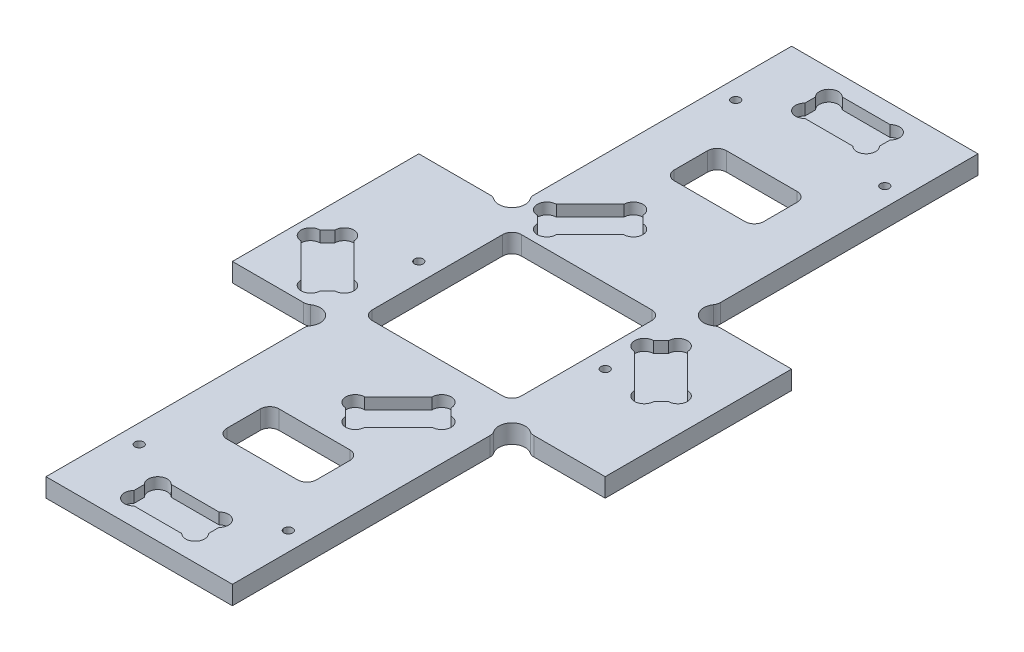
from build123d import *

# Parameters (mm, degrees)
SKETCH1_W                = 31.75
SKETCH1_H                = 63.5
BOSS_EXTRUDE1_DEPTH      = 6.35
CUT_EXTRUDE14_DEPTH      = 3.81
SKETCH14_W               = 25.4
SKETCH14_H               = 12.7
CUT_EXTRUDE16_DEPTH      = 3.81
SKETCH15_W               = 30.48
SKETCH15_H               = 17.78
SKETCH15_W_2             = 50.8
SKETCH15_H_2             = 50.8
CUT_EXTRUDE17_DEPTH      = 271.379606021
FILLET1_R                = 3.175
SKETCH16_R               = 4.490128061
SKETCH16_W               = 3.175
SKETCH16_H               = 3.175
CUT_EXTRUDE18_DEPTH      = 271.379606021
FILLET2_R                = 3.175
SKETCH17_W               = 2.286
SKETCH17_H               = 2.286
SKETCH17_R               = 3.232892204
CUT_EXTRUDE19_DEPTH      = 3.81
SKETCH18_R               = 3.232892204
CUT_EXTRUDE20_DEPTH      = 3.81
SKETCH19_R               = 3.232892204
CUT_EXTRUDE22_DEPTH      = 3.81
CUT_EXTRUDE23_DEPTH      = 271.379606021
CUT_EXTRUDE23_DEPTH_BACK = 271.379606021
SKETCH20_R               = 1.4732


with BuildPart() as part:
    # Sketch1 → Boss-Extrude1 (new body)
    with BuildSketch(Plane(origin=(0, 0, 0), x_dir=(1, 0, 0), z_dir=(0, 1, 0))):
        with Locations((-2.219314381, 120.395150502)):
            Rectangle(SKETCH1_W, SKETCH1_H)
        Polygon((45.405685619, -6.604849498), (45.405685619, 247.395150502), (13.655685619, 247.395150502), (13.655685619, 152.145150502), (13.655685619, 88.645150502), (13.655685619, -6.604849498), align=None)
        Polygon((77.155685619, 247.395150502), (45.405685619, 247.395150502), (45.405685619, -6.604849498), (77.155685619, -6.604849498), (77.155685619, 88.645150502), (77.155685619, 152.145150502), align=None)
        with Locations((93.030685619, 120.395150502)):
            Rectangle(SKETCH1_W, SKETCH1_H)
    extrude(amount=BOSS_EXTRUDE1_DEPTH)

    # Sketch2 → Cut-Extrude14 (cut)
    with BuildSketch(Plane(origin=(0, 6.35, 0), x_dir=(1, 0, 0), z_dir=(0, 1, 0))):
        Polygon((-6.679799883, 118.599099277), (-15.660056005, 109.618843156), (2.300456238, 91.658330914), (11.280712359, 100.638587035), align=None)
        Polygon((25.962587035, 148.485287641), (16.982330914, 157.465543762), (34.942843156, 175.426056005), (43.923099277, 166.445799883), align=None)
        Polygon((73.809287641, 133.803412965), (82.789543762, 142.783669086), (100.750056005, 124.823156844), (91.769799883, 115.842900723), align=None)
        Polygon((59.127412965, 85.956712359), (68.107669086, 76.976456238), (50.147156844, 59.015943995), (41.166900723, 67.996200117), align=None)
    extrude(amount=-CUT_EXTRUDE14_DEPTH, mode=Mode.SUBTRACT)

    # Sketch14 → Cut-Extrude16 (cut)
    with BuildSketch(Plane(origin=(0, 6.35, 0), x_dir=(1, 0, 0), z_dir=(0, 1, 0))):
        with Locations((45.405685619, 234.695150502)):
            Rectangle(SKETCH14_W, SKETCH14_H)
        with Locations((45.405685619, 6.095150502)):
            Rectangle(SKETCH14_W, SKETCH14_H)
    extrude(amount=-CUT_EXTRUDE16_DEPTH, mode=Mode.SUBTRACT)

    # Sketch15 → Cut-Extrude17 (cut, through all)
    with BuildSketch(Plane(origin=(0, 6.35, 0), x_dir=(1, 0, 0), z_dir=(0, 1, 0))):
        with Locations((45.405685619, 44.195150502)):
            Rectangle(SKETCH15_W, SKETCH15_H)
        with Locations((45.405685619, 120.395150502)):
            Rectangle(SKETCH15_W_2, SKETCH15_H_2)
        with Locations((45.405685619, 196.595150502)):
            Rectangle(SKETCH15_W, SKETCH15_H)
    extrude(amount=-CUT_EXTRUDE17_DEPTH, mode=Mode.SUBTRACT)

    # Fillet1
    fillet1_edges = [part.edges().sort_by_distance(p)[0] for p in [
        (30.165685619, 3.175, -35.305150502),
        (30.165685619, 3.175, -53.085150502),
        (60.645685619, 3.175, -53.085150502),
        (60.645685619, 3.175, -35.305150502),
        (60.645685619, 3.175, -205.485150502),
        (60.645685619, 3.175, -187.705150502),
        (30.165685619, 3.175, -187.705150502),
        (30.165685619, 3.175, -205.485150502),
        (70.805685619, 3.175, -145.795150502),
        (70.805685619, 3.175, -94.995150502),
        (20.005685619, 3.175, -94.995150502),
        (20.005685619, 3.175, -145.795150502),
    ]]
    fillet(fillet1_edges, radius=FILLET1_R)

    # Sketch16 → Cut-Extrude18 (cut, through all)
    with BuildSketch(Plane(origin=(0, 6.35, 0), x_dir=(1, 0, 0), z_dir=(0, 1, 0))):
        with Locations((10.480685619, 85.470150502)):
            Circle(SKETCH16_R)
        with Locations((12.068185619, 87.057650502)):
            Rectangle(SKETCH16_W, SKETCH16_H)
        with Locations((12.068185619, 87.057650502)):
            Rectangle(SKETCH16_W, SKETCH16_H)
        with Locations((78.743185619, 87.057650502)):
            Rectangle(SKETCH16_W, SKETCH16_H)
        with Locations((80.330685619, 85.470150502)):
            Circle(SKETCH16_R)
        with Locations((78.743185619, 87.057650502)):
            Rectangle(SKETCH16_W, SKETCH16_H)
        with Locations((78.743185619, 153.732650502)):
            Rectangle(SKETCH16_W, SKETCH16_H)
        with Locations((80.330685619, 155.320150502)):
            Circle(SKETCH16_R)
        with Locations((78.743185619, 153.732650502)):
            Rectangle(SKETCH16_W, SKETCH16_H)
        with Locations((12.068185619, 153.732650502)):
            Rectangle(SKETCH16_W, SKETCH16_H)
        with Locations((10.480685619, 155.320150502)):
            Circle(SKETCH16_R)
        with Locations((12.068185619, 153.732650502)):
            Rectangle(SKETCH16_W, SKETCH16_H)
    extrude(amount=-CUT_EXTRUDE18_DEPTH, mode=Mode.SUBTRACT)

    # Fillet2
    fillet2_edges = [part.edges().sort_by_distance(p)[0] for p in [
        (7.305685619, 3.175, -152.145150502),
        (13.655685619, 3.175, -158.495150502),
        (83.505685619, 3.175, -152.145150502),
        (77.155685619, 3.175, -158.495150502),
        (77.155685619, 3.175, -82.295150502),
        (83.505685619, 3.175, -88.645150502),
        (7.305685619, 3.175, -88.645150502),
        (13.655685619, 3.175, -82.295150502),
    ]]
    fillet(fillet2_edges, radius=FILLET2_R)

    # Sketch17 → Cut-Extrude19 (cut)
    with BuildSketch(Plane(origin=(0, 6.35, 0), x_dir=(1, 0, 0), z_dir=(0, 1, 0))):
        with Locations((33.848685619, 239.902150502)):
            Rectangle(SKETCH17_W, SKETCH17_H)
        with Locations((34.991685619, 238.759150502)):
            Circle(SKETCH17_R)
        with Locations((33.848685619, 239.902150502)):
            Rectangle(SKETCH17_W, SKETCH17_H)
        with Locations((55.819685619, 238.759150502)):
            Circle(SKETCH17_R)
        with Locations((56.962685619, 239.902150502)):
            Rectangle(SKETCH17_W, SKETCH17_H)
        with Locations((56.962685619, 239.902150502)):
            Rectangle(SKETCH17_W, SKETCH17_H)
        with Locations((55.819685619, 230.631150502)):
            Circle(SKETCH17_R)
        with Locations((56.962685619, 229.488150502)):
            Rectangle(SKETCH17_W, SKETCH17_H)
        with Locations((56.962685619, 229.488150502)):
            Rectangle(SKETCH17_W, SKETCH17_H)
        with Locations((34.991685619, 230.631150502)):
            Circle(SKETCH17_R)
        with Locations((33.848685619, 229.488150502)):
            Rectangle(SKETCH17_W, SKETCH17_H)
        with Locations((33.848685619, 229.488150502)):
            Rectangle(SKETCH17_W, SKETCH17_H)
        with Locations((34.991685619, 2.031150502)):
            Circle(SKETCH17_R)
        with Locations((33.848685619, 0.888150502)):
            Rectangle(SKETCH17_W, SKETCH17_H)
        with Locations((33.848685619, 0.888150502)):
            Rectangle(SKETCH17_W, SKETCH17_H)
        with Locations((34.991685619, 10.159150502)):
            Circle(SKETCH17_R)
        with Locations((33.848685619, 11.302150502)):
            Rectangle(SKETCH17_W, SKETCH17_H)
        with Locations((33.848685619, 11.302150502)):
            Rectangle(SKETCH17_W, SKETCH17_H)
        with Locations((55.819685619, 10.159150502)):
            Circle(SKETCH17_R)
        with Locations((56.962685619, 11.302150502)):
            Rectangle(SKETCH17_W, SKETCH17_H)
        with Locations((56.962685619, 11.302150502)):
            Rectangle(SKETCH17_W, SKETCH17_H)
        with Locations((55.819685619, 2.031150502)):
            Circle(SKETCH17_R)
        with Locations((56.962685619, 0.888150502)):
            Rectangle(SKETCH17_W, SKETCH17_H)
        with Locations((56.962685619, 0.888150502)):
            Rectangle(SKETCH17_W, SKETCH17_H)
    extrude(amount=-CUT_EXTRUDE19_DEPTH, mode=Mode.SUBTRACT)

    # Sketch18 → Cut-Extrude20 (cut)
    with BuildSketch(Plane(origin=(0, 6.35, 0), x_dir=(1, 0, 0), z_dir=(0, 1, 0))):
        Polygon((-15.660056005, 109.618843156), (-14.043609903, 108.002397055), (-12.427163801, 109.618843156), (-14.043609903, 111.235289258), align=None)
        with Locations((-12.427163801, 109.618843156)):
            Circle(SKETCH18_R)
        Polygon((-15.660056005, 109.618843156), (-14.043609903, 108.002397055), (-12.427163801, 109.618843156), (-14.043609903, 111.235289258), align=None)
        Polygon((-6.679799883, 118.599099277), (-5.063353782, 116.982653176), (-6.679799883, 115.366207074), (-8.296245985, 116.982653176), align=None)
        with Locations((-6.679799883, 115.366207074)):
            Circle(SKETCH18_R)
        Polygon((-6.679799883, 118.599099277), (-8.296245985, 116.982653176), (-6.679799883, 115.366207074), (-5.063353782, 116.982653176), align=None)
        Polygon((9.664266257, 99.022140934), (8.047820155, 100.638587035), (9.664266257, 102.255033137), (11.280712359, 100.638587035), align=None)
        with Locations((8.047820155, 100.638587035)):
            Circle(SKETCH18_R)
        Polygon((11.280712359, 100.638587035), (9.664266257, 102.255033137), (8.047820155, 100.638587035), (9.664266257, 99.022140934), align=None)
        Polygon((2.300456238, 91.658330914), (0.684010136, 93.274777016), (2.300456238, 94.891223118), (3.916902339, 93.274777016), align=None)
        with Locations((2.300456238, 94.891223118)):
            Circle(SKETCH18_R)
        Polygon((2.300456238, 91.658330914), (3.916902339, 93.274777016), (2.300456238, 94.891223118), (0.684010136, 93.274777016), align=None)
    extrude(amount=-CUT_EXTRUDE20_DEPTH, mode=Mode.SUBTRACT)

    # Sketch19 → Cut-Extrude22 (cut)
    # profile 1 of 27: a face of its own
    with BuildSketch(Plane(origin=(0, 6.35, 0), x_dir=(1, 0, 0), z_dir=(0, 1, 0))):
        with Locations((44.399792926, 67.996200117)):
            Circle(SKETCH19_R)
        Polygon((41.166900723, 67.996200117), (42.783346824, 66.379754015), (44.399792926, 67.996200117), (42.783346824, 69.612646218), align=None, mode=Mode.SUBTRACT)
    # profile 2 of 27: a face of its own
    with BuildSketch(Plane(origin=(0, 6.35, 0), x_dir=(1, 0, 0), z_dir=(0, 1, 0))):
        with Locations((50.147156844, 62.248836199)):
            Circle(SKETCH19_R)
        Polygon((50.147156844, 59.015943995), (51.763602945, 60.632390097), (50.147156844, 62.248836199), (48.530710742, 60.632390097), align=None, mode=Mode.SUBTRACT)
    # profile 3 of 27: a face of its own
    with BuildSketch(Plane(origin=(0, 6.35, 0), x_dir=(1, 0, 0), z_dir=(0, 1, 0))):
        Polygon((50.147156844, 59.015943995), (48.530710742, 60.632390097), (50.147156844, 62.248836199), (51.763602945, 60.632390097), align=None)
    # profile 4 of 27: a face of its own
    with BuildSketch(Plane(origin=(0, 6.35, 0), x_dir=(1, 0, 0), z_dir=(0, 1, 0))):
        Polygon((59.127412965, 85.956712359), (60.743859066, 84.340266257), (59.127412965, 82.723820155), (57.510966863, 84.340266257), align=None)
    # profile 5 of 27: a face of its own
    with BuildSketch(Plane(origin=(0, 6.35, 0), x_dir=(1, 0, 0), z_dir=(0, 1, 0))):
        with Locations((59.127412965, 82.723820155)):
            Circle(SKETCH19_R)
    # profile 6 of 27: a face of its own
    with BuildSketch(Plane(origin=(0, 6.35, 0), x_dir=(1, 0, 0), z_dir=(0, 1, 0))):
        Polygon((59.127412965, 85.956712359), (57.510966863, 84.340266257), (59.127412965, 82.723820155), (60.743859066, 84.340266257), align=None)
    # profile 7 of 27: a face of its own
    with BuildSketch(Plane(origin=(0, 6.35, 0), x_dir=(1, 0, 0), z_dir=(0, 1, 0))):
        Polygon((66.491222984, 75.360010136), (64.874776882, 76.976456238), (66.491222984, 78.592902339), (68.107669086, 76.976456238), align=None)
    # profile 8 of 27: a face of its own
    with BuildSketch(Plane(origin=(0, 6.35, 0), x_dir=(1, 0, 0), z_dir=(0, 1, 0))):
        with Locations((64.874776882, 76.976456238)):
            Circle(SKETCH19_R)
    # profile 9 of 27: a face of its own
    with BuildSketch(Plane(origin=(0, 6.35, 0), x_dir=(1, 0, 0), z_dir=(0, 1, 0))):
        Polygon((68.107669086, 76.976456238), (66.491222984, 78.592902339), (64.874776882, 76.976456238), (66.491222984, 75.360010136), align=None)
    # profile 10 of 27: a face of its own
    with BuildSketch(Plane(origin=(0, 6.35, 0), x_dir=(1, 0, 0), z_dir=(0, 1, 0))):
        with Locations((91.769799883, 119.075792926)):
            Circle(SKETCH19_R)
        Polygon((91.769799883, 115.842900723), (93.386245985, 117.459346824), (91.769799883, 119.075792926), (90.153353782, 117.459346824), align=None, mode=Mode.SUBTRACT)
    # profile 11 of 27: a face of its own
    with BuildSketch(Plane(origin=(0, 6.35, 0), x_dir=(1, 0, 0), z_dir=(0, 1, 0))):
        Polygon((91.769799883, 115.842900723), (93.386245985, 117.459346824), (91.769799883, 119.075792926), (90.153353782, 117.459346824), align=None)
    # profile 12 of 27: a face of its own
    with BuildSketch(Plane(origin=(0, 6.35, 0), x_dir=(1, 0, 0), z_dir=(0, 1, 0))):
        with Locations((97.517163801, 124.823156844)):
            Circle(SKETCH19_R)
        Polygon((100.750056005, 124.823156844), (99.133609903, 126.439602945), (97.517163801, 124.823156844), (99.133609903, 123.206710742), align=None, mode=Mode.SUBTRACT)
    # profile 13 of 27: a face of its own
    with BuildSketch(Plane(origin=(0, 6.35, 0), x_dir=(1, 0, 0), z_dir=(0, 1, 0))):
        Polygon((100.750056005, 124.823156844), (99.133609903, 123.206710742), (97.517163801, 124.823156844), (99.133609903, 126.439602945), align=None)
    # profile 14 of 27: a face of its own
    with BuildSketch(Plane(origin=(0, 6.35, 0), x_dir=(1, 0, 0), z_dir=(0, 1, 0))):
        with Locations((82.789543762, 139.550776882)):
            Circle(SKETCH19_R)
        Polygon((82.789543762, 142.783669086), (81.173097661, 141.167222984), (82.789543762, 139.550776882), (84.405989864, 141.167222984), align=None, mode=Mode.SUBTRACT)
    # profile 15 of 27: a face of its own
    with BuildSketch(Plane(origin=(0, 6.35, 0), x_dir=(1, 0, 0), z_dir=(0, 1, 0))):
        Polygon((84.405989864, 141.167222984), (82.789543762, 139.550776882), (81.173097661, 141.167222984), (82.789543762, 142.783669086), align=None)
    # profile 16 of 27: a face of its own
    with BuildSketch(Plane(origin=(0, 6.35, 0), x_dir=(1, 0, 0), z_dir=(0, 1, 0))):
        with Locations((77.042179845, 133.803412965)):
            Circle(SKETCH19_R)
        Polygon((73.809287641, 133.803412965), (75.425733743, 132.186966863), (77.042179845, 133.803412965), (75.425733743, 135.419859066), align=None, mode=Mode.SUBTRACT)
    # profile 17 of 27: a face of its own
    with BuildSketch(Plane(origin=(0, 6.35, 0), x_dir=(1, 0, 0), z_dir=(0, 1, 0))):
        Polygon((73.809287641, 133.803412965), (75.425733743, 135.419859066), (77.042179845, 133.803412965), (75.425733743, 132.186966863), align=None)
    # profile 18 of 27: a face of its own
    with BuildSketch(Plane(origin=(0, 6.35, 0), x_dir=(1, 0, 0), z_dir=(0, 1, 0))):
        with Locations((25.962587035, 151.718179845)):
            Circle(SKETCH19_R)
        Polygon((25.962587035, 148.485287641), (27.579033137, 150.101733743), (25.962587035, 151.718179845), (24.346140934, 150.101733743), align=None, mode=Mode.SUBTRACT)
    # profile 19 of 27: a face of its own
    with BuildSketch(Plane(origin=(0, 6.35, 0), x_dir=(1, 0, 0), z_dir=(0, 1, 0))):
        Polygon((25.962587035, 148.485287641), (27.579033137, 150.101733743), (25.962587035, 151.718179845), (24.346140934, 150.101733743), align=None)
    # profile 20 of 27: a face of its own
    with BuildSketch(Plane(origin=(0, 6.35, 0), x_dir=(1, 0, 0), z_dir=(0, 1, 0))):
        with Locations((20.215223118, 157.465543762)):
            Circle(SKETCH19_R)
        Polygon((16.982330914, 157.465543762), (18.598777016, 155.849097661), (20.215223118, 157.465543762), (18.598777016, 159.081989864), align=None, mode=Mode.SUBTRACT)
    # profile 21 of 27: a face of its own
    with BuildSketch(Plane(origin=(0, 6.35, 0), x_dir=(1, 0, 0), z_dir=(0, 1, 0))):
        Polygon((16.982330914, 157.465543762), (18.598777016, 159.081989864), (20.215223118, 157.465543762), (18.598777016, 155.849097661), align=None)
    # profile 22 of 27: a face of its own
    with BuildSketch(Plane(origin=(0, 6.35, 0), x_dir=(1, 0, 0), z_dir=(0, 1, 0))):
        Polygon((36.559289258, 173.809609903), (34.942843156, 172.193163801), (33.326397055, 173.809609903), (34.942843156, 175.426056005), align=None)
    # profile 23 of 27: a face of its own
    with BuildSketch(Plane(origin=(0, 6.35, 0), x_dir=(1, 0, 0), z_dir=(0, 1, 0))):
        with Locations((34.942843156, 172.193163801)):
            Circle(SKETCH19_R)
    # profile 24 of 27: a face of its own
    with BuildSketch(Plane(origin=(0, 6.35, 0), x_dir=(1, 0, 0), z_dir=(0, 1, 0))):
        Polygon((34.942843156, 175.426056005), (33.326397055, 173.809609903), (34.942843156, 172.193163801), (36.559289258, 173.809609903), align=None)
    # profile 25 of 27: a face of its own
    with BuildSketch(Plane(origin=(0, 6.35, 0), x_dir=(1, 0, 0), z_dir=(0, 1, 0))):
        with Locations((40.690207074, 166.445799883)):
            Circle(SKETCH19_R)
        Polygon((43.923099277, 166.445799883), (42.306653176, 168.062245985), (40.690207074, 166.445799883), (42.306653176, 164.829353782), align=None, mode=Mode.SUBTRACT)
    # profile 26 of 27: a face of its own
    with BuildSketch(Plane(origin=(0, 6.35, 0), x_dir=(1, 0, 0), z_dir=(0, 1, 0))):
        Polygon((43.923099277, 166.445799883), (42.306653176, 164.829353782), (40.690207074, 166.445799883), (42.306653176, 168.062245985), align=None)
    # profile 27 of 27: a face of its own
    with BuildSketch(Plane(origin=(0, 6.35, 0), x_dir=(1, 0, 0), z_dir=(0, 1, 0))):
        Polygon((41.166900723, 67.996200117), (42.783346824, 66.379754015), (44.399792926, 67.996200117), (42.783346824, 69.612646218), align=None)
    extrude(amount=-CUT_EXTRUDE22_DEPTH, mode=Mode.SUBTRACT)

    # Sketch20 → Cut-Extrude23 (cut, two sides: drawn at the far end of the back side and taken through both)
    with BuildSketch(Plane(origin=(0, 6.35, 0), x_dir=(1, 0, 0), z_dir=(0, 1, 0)).offset(-CUT_EXTRUDE23_DEPTH_BACK)):
        with Locations(Location((20.005685619, 221.995150502, 0), (0, 0, 270))):
            Circle(SKETCH20_R)
        with Locations(Location((70.805685619, 221.995150502, 0), (0, 0, 270))):
            Circle(SKETCH20_R)
        with Locations(Location((70.805685619, 18.795150502, 0), (0, 0, 270))):
            Circle(SKETCH20_R)
        with Locations(Location((20.005685619, 18.795150502, 0), (0, 0, 270))):
            Circle(SKETCH20_R)
        with Locations(Location((13.655685619, 120.395150502, 0), (0, 0, 270))):
            Circle(SKETCH20_R)
        with Locations(Location((77.155685619, 120.395150502, 0), (0, 0, 270))):
            Circle(SKETCH20_R)
    extrude(amount=CUT_EXTRUDE23_DEPTH + CUT_EXTRUDE23_DEPTH_BACK, mode=Mode.SUBTRACT)


solid = part.part
